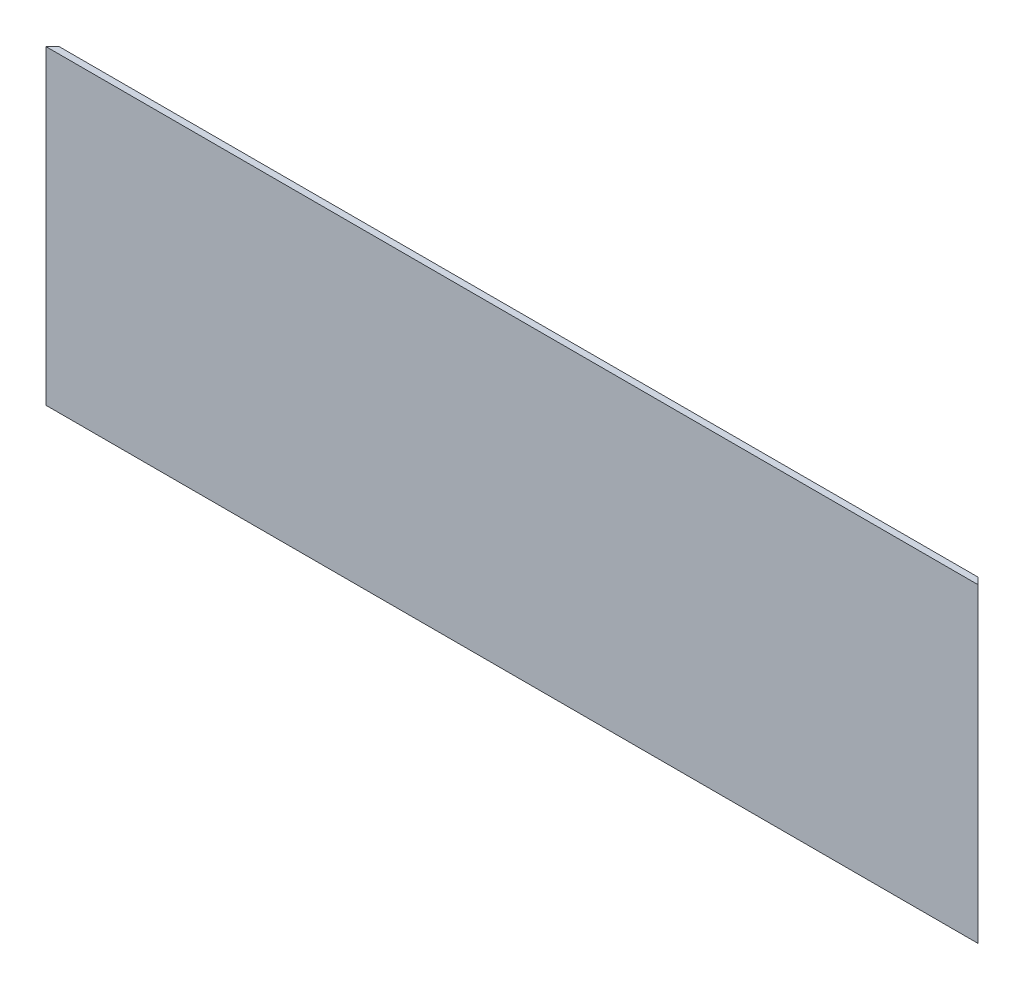
from build123d import *

# Parameters (mm, degrees)
SKETCH1_W           = 450
SKETCH1_H           = 150
BOSS_EXTRUDE1_DEPTH = 3.175
CUT_EXTRUDE1_DEPTH  = 475.352274818


with BuildPart() as part:
    # Sketch1 → Boss-Extrude1 (new body)
    with BuildSketch(Plane.XY):
        with Locations((225, 75)):
            Rectangle(SKETCH1_W, SKETCH1_H)
    extrude(amount=BOSS_EXTRUDE1_DEPTH)

    # Sketch2 → Cut-Extrude1 (cut, through all)
    with BuildSketch(Plane(origin=(0, 150, 0), x_dir=(1, 0, 0), z_dir=(0, 1, 0))):
        Polygon((0, -3.175), (3.175, 0), (0, 0), align=None)
        Polygon((450, -3.175), (446.825, 0), (450, 0), align=None)
    extrude(amount=-CUT_EXTRUDE1_DEPTH, mode=Mode.SUBTRACT)


solid = part.part
